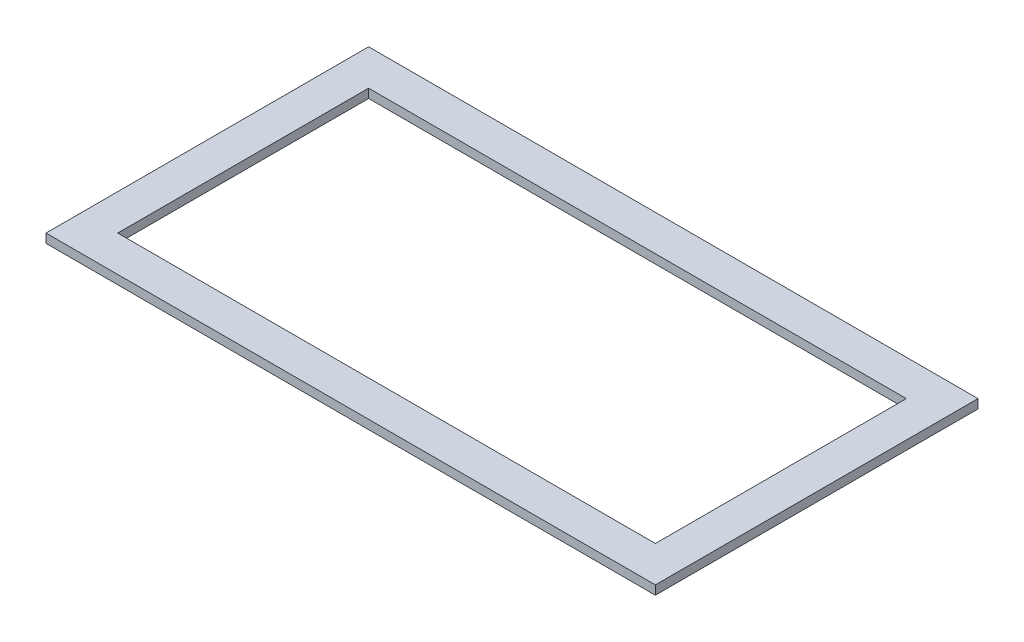
from build123d import *

# Parameters (mm, degrees)
SKETCH1_W           = 215.9
SKETCH1_H           = 114.3
BOSS_EXTRUDE1_DEPTH = 3.175
SKETCH2_W           = 190.5
SKETCH2_H           = 88.9
CUT_EXTRUDE1_DEPTH  = 3.175


with BuildPart() as part:
    # Sketch1 → Boss-Extrude1 (new body)
    with BuildSketch(Plane(origin=(0, 0, 0), x_dir=(1, 0, 0), z_dir=(0, 1, 0))):
        Rectangle(SKETCH1_W, SKETCH1_H)
    extrude(amount=BOSS_EXTRUDE1_DEPTH)

    # Sketch2 → Cut-Extrude1 (cut)
    with BuildSketch(Plane(origin=(0, 3.175, 0), x_dir=(1, 0, 0), z_dir=(0, 1, 0))):
        Rectangle(SKETCH2_W, SKETCH2_H)
    extrude(amount=-CUT_EXTRUDE1_DEPTH, mode=Mode.SUBTRACT)


solid = part.part
